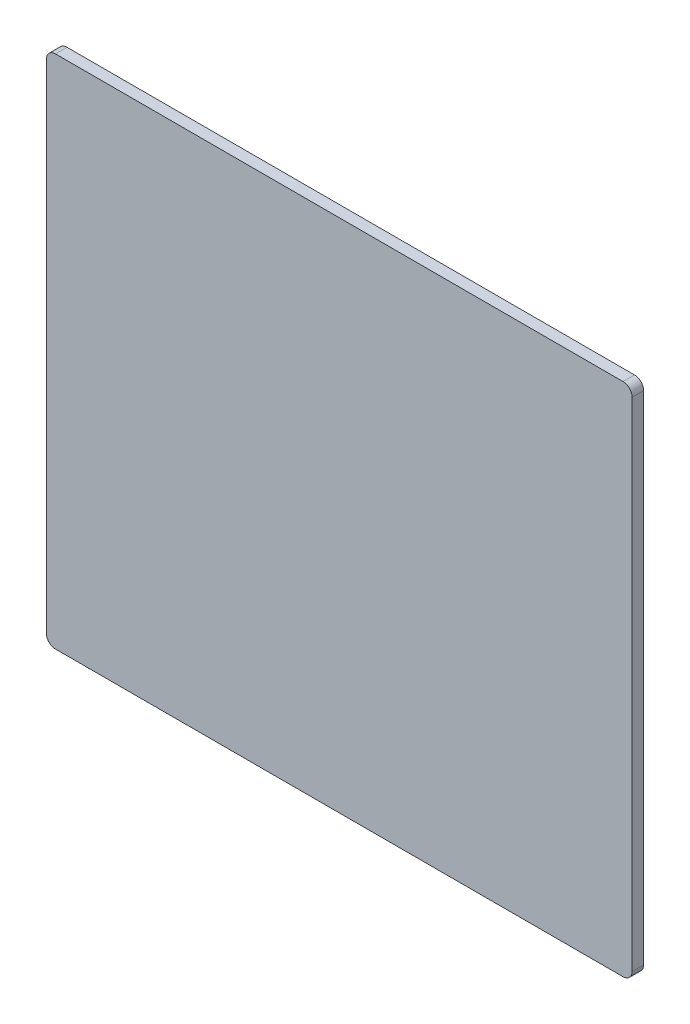
from build123d import *

# Parameters (mm, degrees)
SKETCH1_W           = 647.7
SKETCH1_H           = 569.976
BOSS_EXTRUDE1_DEPTH = 12.7
FILLET1_R           = 10


with BuildPart() as part:
    # Sketch1 → Boss-Extrude1 (new body)
    with BuildSketch(Plane.XY):
        with Locations((-152.648046875, -147.520421875)):
            Rectangle(SKETCH1_W, SKETCH1_H)
    extrude(amount=BOSS_EXTRUDE1_DEPTH)

    # Fillet1
    fillet1_edges = [part.edges().sort_by_distance(p)[0] for p in [
        (-476.498046875, 137.467578125, 6.35),
        (171.201953125, 137.467578125, 6.35),
        (171.201953125, -432.508421875, 6.35),
        (-476.498046875, -432.508421875, 6.35),
    ]]
    fillet(fillet1_edges, radius=FILLET1_R)


solid = part.part
